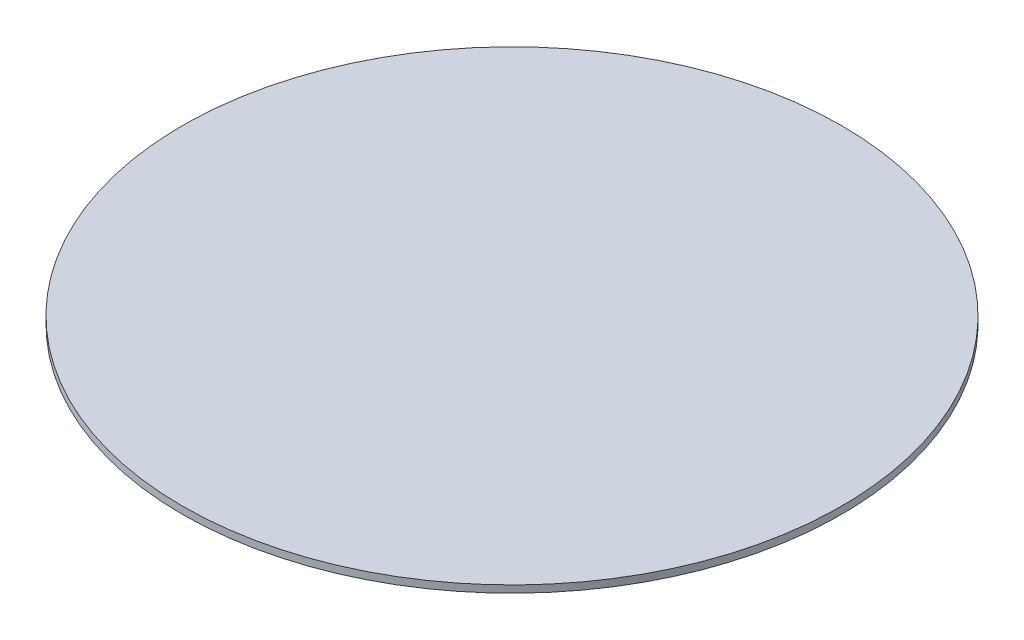
from build123d import *

# Parameters (mm, degrees)
SKETCH1_R           = 23
BOSS_EXTRUDE1_DEPTH = 0.5


with BuildPart() as part:
    # Sketch1 → Boss-Extrude1 (new body)
    with BuildSketch(Plane(origin=(0, 0, 0), x_dir=(1, 0, 0), z_dir=(0, 1, 0))):
        with Locations(Location((0, 0, 0), (0, 0, 270))):
            Circle(SKETCH1_R)
    extrude(amount=BOSS_EXTRUDE1_DEPTH)


solid = part.part
